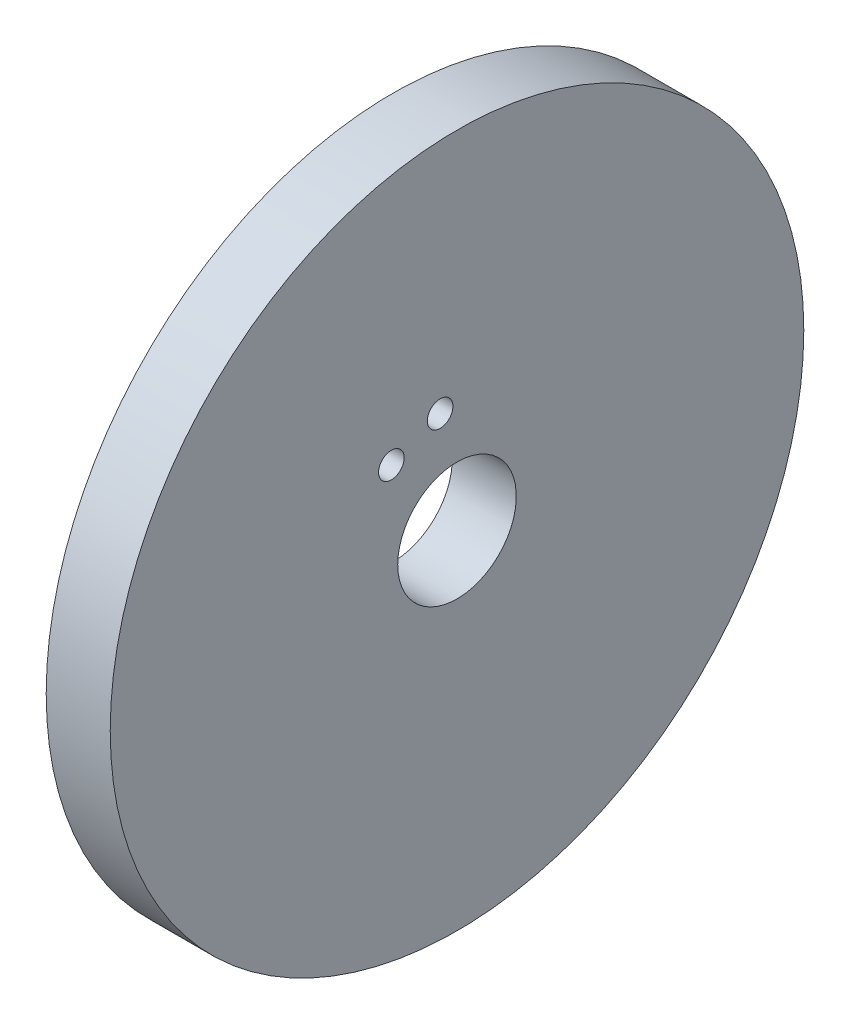
from build123d import *

# Parameters (mm, degrees)
AXIAL_PROFILE_MM_W     = 12
AXIAL_PROFILE_MM_H     = 53.8875
AXIAL_HOLES_DEPTH      = 96.448886845
AXIAL_HOLES_DEPTH_BACK = 96.448886845
SKETCH2_R              = 2.4
CUT_EXTRUDE2_START     = 13.7
SKETCH3_R              = 1.55
CUT_EXTRUDE2_DEPTH     = 7


with BuildPart() as part:
    # Axial profile (mm) → Full revolution (revolve)
    with BuildSketch(Plane.XY, mode=Mode.PRIVATE) as full_revolution_sk:
        with Locations((19.7, 38.05625)):
            Rectangle(AXIAL_PROFILE_MM_W, AXIAL_PROFILE_MM_H)
    revolve(full_revolution_sk.sketch.rotate(Axis((-110, 0, 0), (1, 0, 0)), 90), axis=Axis((-110, 0, 0), (1, 0, 0)))

    # Sketch2 → Axial holes (cut, two sides: drawn at the far end of the back side and taken through both)
    with BuildSketch(Plane(origin=(0, 0, 0), x_dir=(0, 0, -1), z_dir=(1, 0, 0)).offset(-AXIAL_HOLES_DEPTH_BACK)):
        with Locations((-3.163812264, 20.557973926)):
            Circle(SKETCH2_R)
        with Locations((-12.299529665, 16.773835877)):
            Circle(SKETCH2_R)
    extrude(amount=AXIAL_HOLES_DEPTH + AXIAL_HOLES_DEPTH_BACK, mode=Mode.SUBTRACT)

    # Sketch3 → Cut-Extrude2 (cut)
    with BuildSketch(Plane(origin=(0, 0, 0), x_dir=(0, 0, -1), z_dir=(1, 0, 0)).offset(CUT_EXTRUDE2_START)):
        with Locations((-31.819805153, 31.819805153)):
            Circle(SKETCH3_R)
        with Locations((-31.819805153, -31.819805153)):
            Circle(SKETCH3_R)
        with Locations((31.819805153, -31.819805153)):
            Circle(SKETCH3_R)
        with Locations((31.819805153, 31.819805153)):
            Circle(SKETCH3_R)
    extrude(amount=CUT_EXTRUDE2_DEPTH, mode=Mode.SUBTRACT)


solid = part.part
